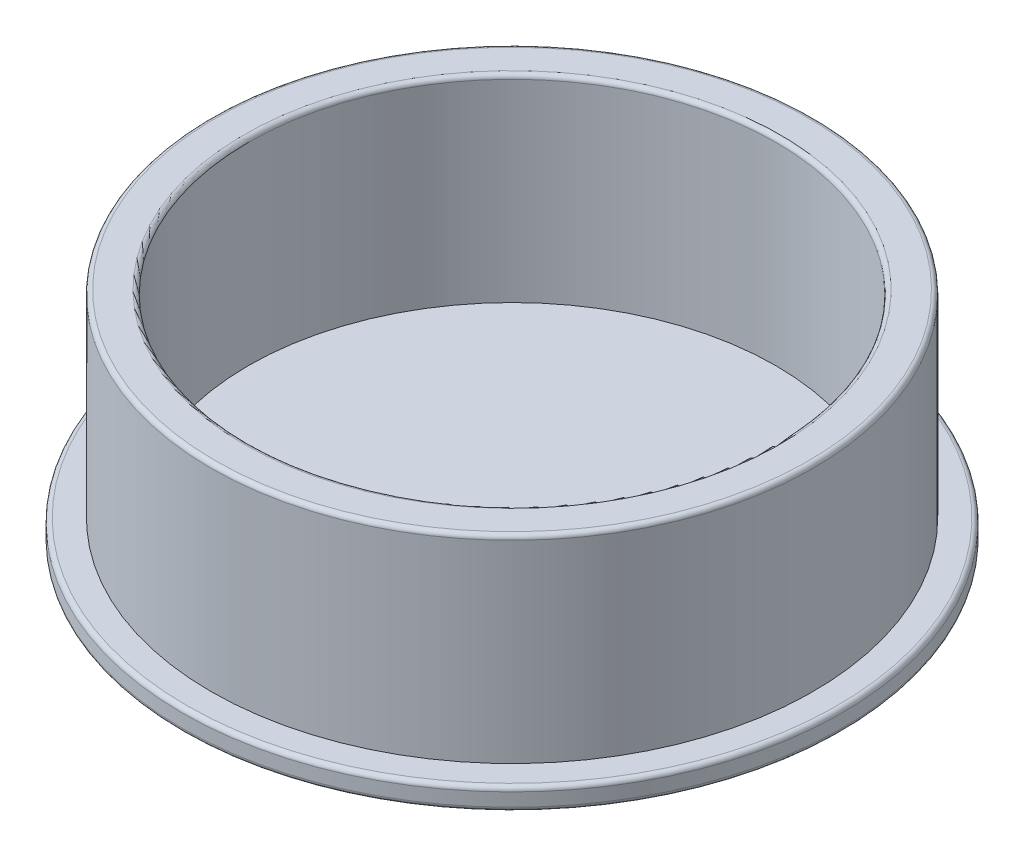
from build123d import *

# Parameters (mm, degrees)
SKETCH_1_R      = 15
EXTRUDE_1_DEPTH = 1
SKETCH_2_R      = 13.7
SKETCH_2_R_2    = 12
EXTRUDE_2_DEPTH = 9
FILLET_1_R      = 0.2


with BuildPart() as part:
    # 草图1 → 凸台-拉伸1 (new body)
    with BuildSketch(Plane(origin=(0, 0, 0), x_dir=(1, 0, 0), z_dir=(0, 1, 0))):
        with Locations(Location((0, 0, 0), (0, 0, 270))):
            Circle(SKETCH_1_R)
    extrude(amount=EXTRUDE_1_DEPTH)

    # 草图2 → 凸台-拉伸2 (add)
    with BuildSketch(Plane(origin=(0, 1, 0), x_dir=(1, 0, 0), z_dir=(0, 1, 0))):
        with Locations(Location((0, 0, 0), (0, 0, 270))):
            Circle(SKETCH_2_R)
        with Locations(Location((0, 0, 0), (0, 0, 270))):
            Circle(SKETCH_2_R_2, mode=Mode.SUBTRACT)
    extrude(amount=EXTRUDE_2_DEPTH)

    # 圆角1
    fillet_1_edges = [part.edges().sort_by_distance(p)[0] for p in [
        (0, 0, -15),
        (0, 1, -15),
        (0, 10, -13.7),
        (0, 10, -12),
    ]]
    fillet(fillet_1_edges, radius=FILLET_1_R)


solid = part.part
